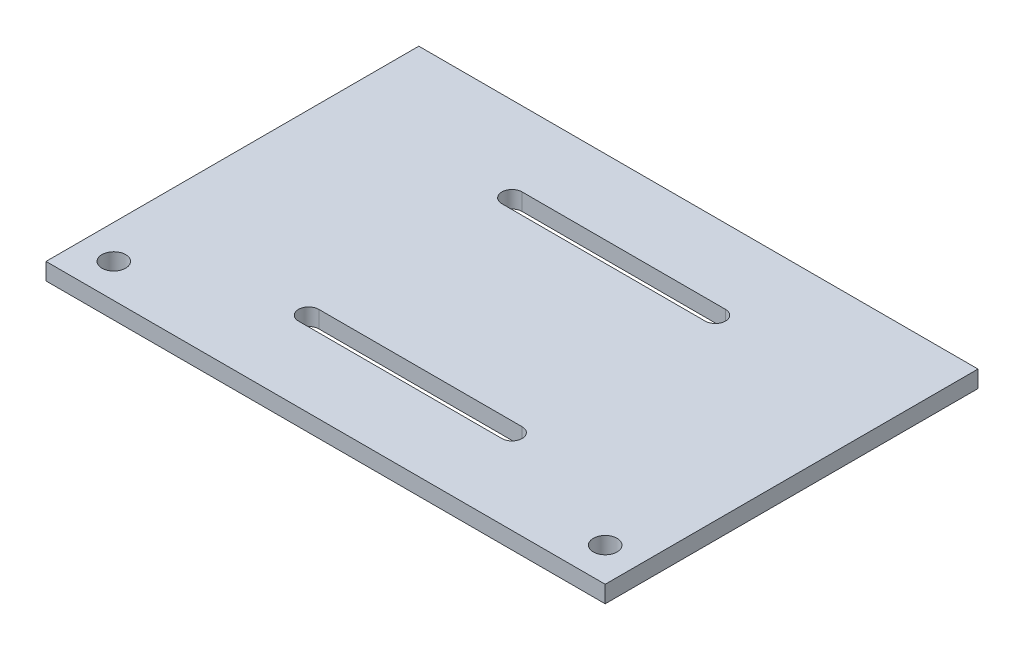
from build123d import *

# Parameters (mm, degrees)
SKETCH1_W           = 165
SKETCH1_H           = 110
SKETCH1_R           = 3.5
BOSS_EXTRUDE1_DEPTH = 5


with BuildPart() as part:
    # Sketch1 → Boss-Extrude1 (new body)
    with BuildSketch(Plane(origin=(0, 0, 0), x_dir=(1, 0, 0), z_dir=(0, 1, 0))):
        Rectangle(SKETCH1_W, SKETCH1_H)
        with Locations(Location((72.5, -45, 0), (0, 0, 270))):
            Circle(SKETCH1_R, mode=Mode.SUBTRACT)
        with Locations(Location((-72.5, -45, 0), (0, 0, 270))):
            Circle(SKETCH1_R, mode=Mode.SUBTRACT)
        with BuildLine():
            Line((30, -33), (-30, -33))
            ThreePointArc((-30, -33), (-33, -30), (-30, -27))
            Line((-30, -27), (30, -27))
            ThreePointArc((30, -27), (33, -30), (30, -33))
        make_face(mode=Mode.SUBTRACT)
        with BuildLine():
            Line((30, 27), (-30, 27))
            ThreePointArc((-30, 27), (-33, 30), (-30, 33))
            Line((-30, 33), (30, 33))
            ThreePointArc((30, 33), (33, 30), (30, 27))
        make_face(mode=Mode.SUBTRACT)
    extrude(amount=BOSS_EXTRUDE1_DEPTH)


solid = part.part
